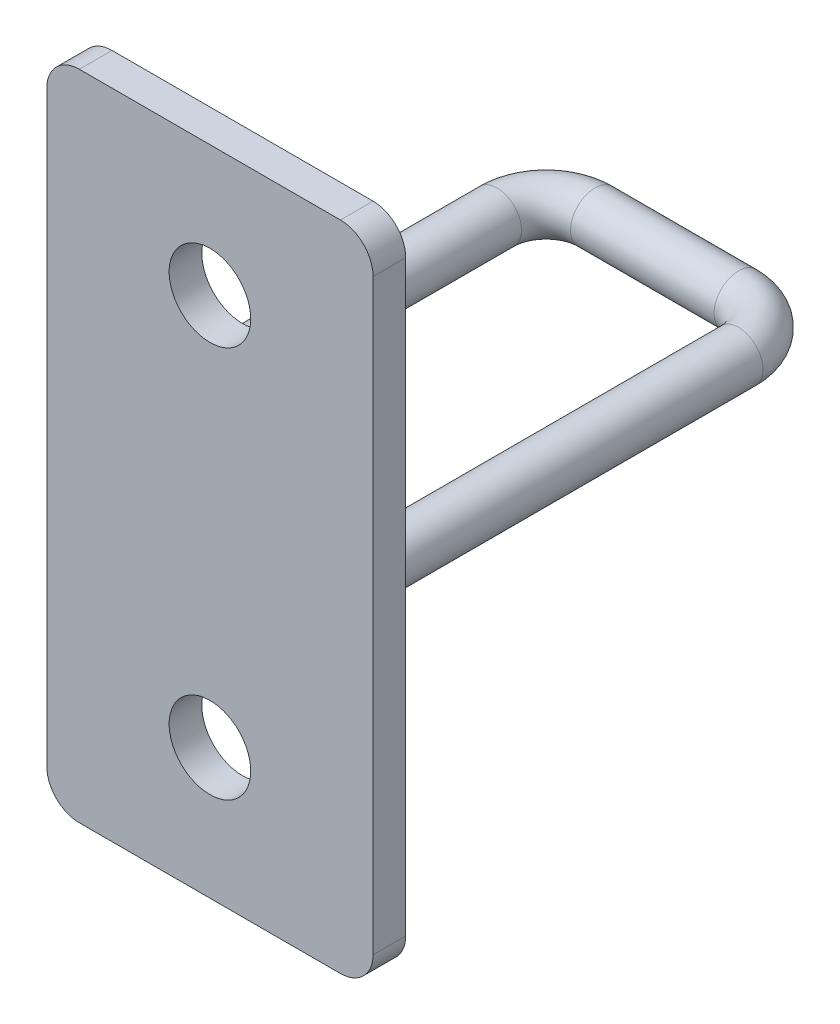
from build123d import *

# Parameters (mm, degrees)
SKETCH_1_W      = 10
SKETCH_1_H      = 20
SKETCH_1_R      = 1.25
EXTRUDE_1_DEPTH = 1
FILLET_1_R      = 1
SKETCH_13_R     = 0.75


with BuildPart() as part:
    # 草图1 → 凸台-拉伸1 (new body)
    with BuildSketch(Plane.XY):
        with Locations((5, -10)):
            Rectangle(SKETCH_1_W, SKETCH_1_H)
        with Locations((5, -4)):
            Circle(SKETCH_1_R, mode=Mode.SUBTRACT)
        with Locations((5, -16)):
            Circle(SKETCH_1_R, mode=Mode.SUBTRACT)
    extrude(amount=EXTRUDE_1_DEPTH)

    # 圆角1
    fillet_1_edges = [part.edges().sort_by_distance(p)[0] for p in [
        (0, 0, 0.5),
        (10, 0, 0.5),
        (10, -20, 0.5),
        (0, -20, 0.5),
    ]]
    fillet(fillet_1_edges, radius=FILLET_1_R)

    # 扫描11: sweep along a path in 草图5
    with BuildLine(Plane(origin=(0, -10, 0), x_dir=(1, 0, 0), z_dir=(0, 1, 0))) as sweep_11_path:
        Line((1.3, 0), (1.3, 11.5))
        ThreePointArc((1.3, 11.5), (1.739339828, 12.560660172), (2.8, 13))
        Line((2.8, 13), (7.2, 13))
        ThreePointArc((7.2, 13), (8.260660172, 12.560660172), (8.7, 11.5))
        Line((8.7, 11.5), (8.7, 0))
    # 草图13 → 扫描11 (sweep)
    with BuildSketch(Plane(origin=(0, 0, 0), x_dir=(-1, 0, 0), z_dir=(0, 0, -1))):
        with Locations((-8.7, -10)):
            Circle(SKETCH_13_R)
    sweep(path=sweep_11_path.line)


solid = part.part
